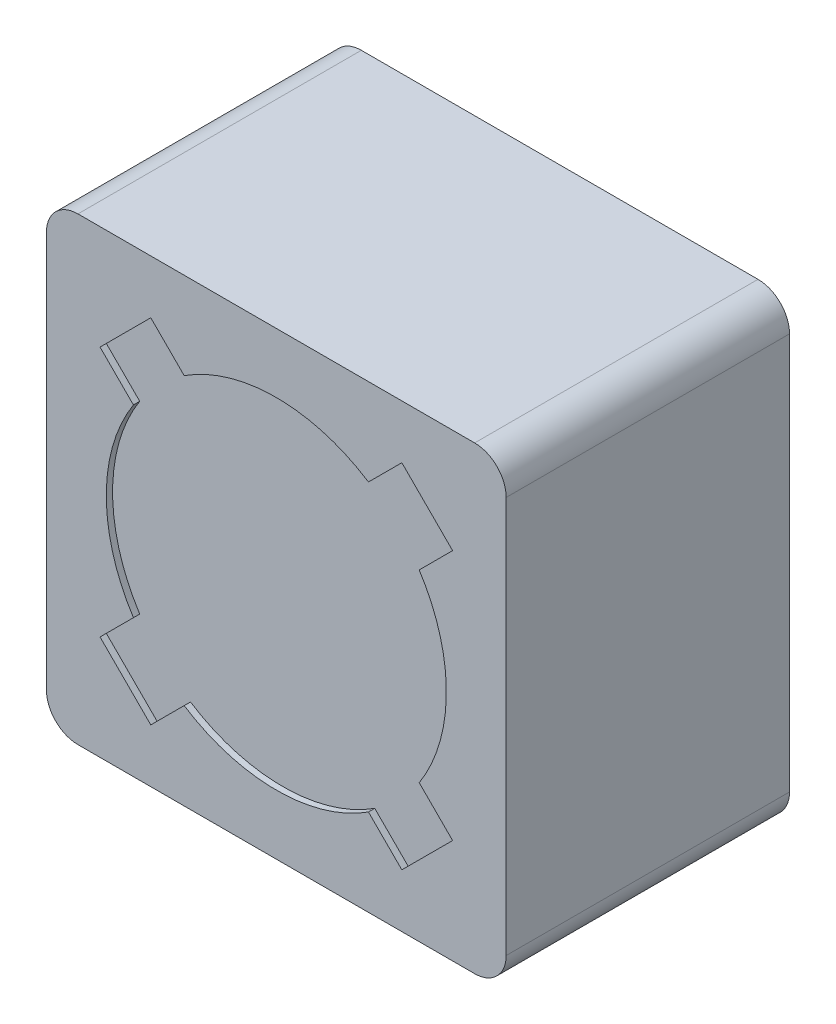
from build123d import *

# Parameters (mm, degrees)
SKETCH_1_W               = 7.3
SKETCH_1_H               = 7.3
EXTRUDE_1_DEPTH          = 4.5
FILLET_1_R               = 0.5
SKETCH_2_R               = 2.7
CUT_EXTRUDE_1_DEPTH      = 0.1
CUT_EXTRUDE_2_DEPTH      = 0.1
PATTERN_CIRCULAR_1_COUNT = 4


with BuildPart() as part:
    # Эскиз1 → Бобышка-Вытянуть1 (new body)
    with BuildSketch(Plane.XY):
        Rectangle(SKETCH_1_W, SKETCH_1_H)
    extrude(amount=EXTRUDE_1_DEPTH)

    # Скругление1
    fillet_1_edges = [part.edges().sort_by_distance(p)[0] for p in [
        (3.65, -3.65, 2.25),
        (-3.65, -3.65, 2.25),
        (-3.65, 3.65, 2.25),
        (3.65, 3.65, 2.25),
    ]]
    fillet(fillet_1_edges, radius=FILLET_1_R)

    # Эскиз2 → Вырез-Вытянуть1 (cut)
    with BuildSketch(Plane.XY.offset(4.5)):
        Circle(SKETCH_2_R)
    extrude(amount=-CUT_EXTRUDE_1_DEPTH, mode=Mode.SUBTRACT)

    # Эскиз3 → Вырез-Вытянуть2 (cut)
    with BuildSketch(Plane.XY.offset(4.5)):
        Polygon((-2.799540108, 1.993438378), (-2.269210022, 1.463108292), (-1.463108292, 2.269210022), (-1.993438378, 2.799540108), align=None)
    cut_extrude_2 = extrude(amount=-CUT_EXTRUDE_2_DEPTH, mode=Mode.SUBTRACT)

    # Круговой массив1: Вырез-Вытянуть2 ×4 about axis
    pattern_circular_1_axis = Axis((0, 0, 0), (0, 0, 1))
    for i in range(1, PATTERN_CIRCULAR_1_COUNT):
        add(cut_extrude_2.rotate(pattern_circular_1_axis, i * 360 / PATTERN_CIRCULAR_1_COUNT), mode=Mode.SUBTRACT)


solid = part.part
